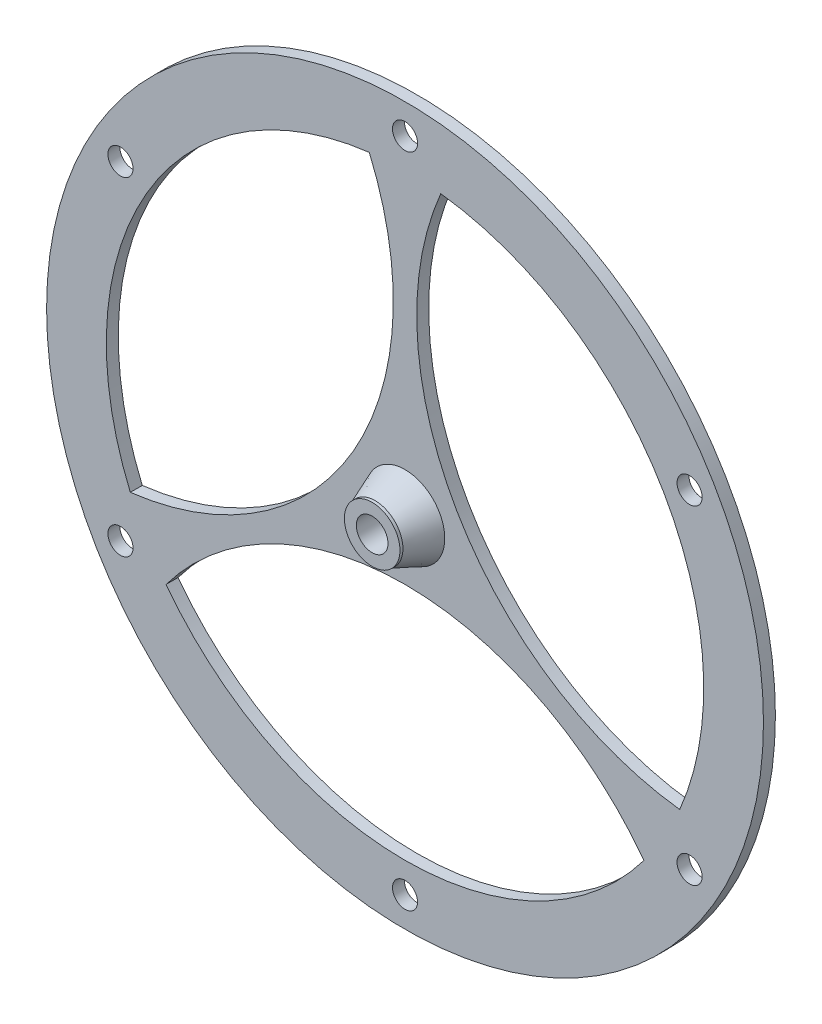
from build123d import *

# Parameters (mm, degrees)
SKETCH1_R           = 60
SKETCH1_R_2         = 2.65
BOSS_EXTRUDE2_DEPTH = 2
CUT_EXTRUDE1_DEPTH  = 85.876380696
CIRPATTERN1_COUNT   = 6
SKETCH3_R           = 4.65
SKETCH3_R_2         = 2.65
BOSS_EXTRUDE3_DEPTH = 5.5
CHAMFER1_SIZE       = 2
CHAMFER1_SIZE2      = 5


with BuildPart() as part:
    # Sketch1 → Boss-Extrude2 (new body)
    with BuildSketch(Plane.XY):
        Circle(SKETCH1_R)
        with BuildLine():
            ThreePointArc((40, -30), (0, -50), (-40, -30))
            ThreePointArc((-40, -30), (0, -10), (40, -30))
        make_face(mode=Mode.SUBTRACT)
        with BuildLine():
            ThreePointArc((-5.980762114, 49.641016151), (-8.660254038, 5), (-45.980762114, -19.641016151))
            ThreePointArc((-45.980762114, -19.641016151), (-43.301270189, 25), (-5.980762114, 49.641016151))
        make_face(mode=Mode.SUBTRACT)
        Circle(SKETCH1_R_2, mode=Mode.SUBTRACT)
        with BuildLine():
            ThreePointArc((5.980762114, 49.641016151), (43.301270189, 25), (45.980762114, -19.641016151))
            ThreePointArc((45.980762114, -19.641016151), (8.660254038, 5), (5.980762114, 49.641016151))
        make_face(mode=Mode.SUBTRACT)
    extrude(amount=BOSS_EXTRUDE2_DEPTH)

    # Sketch2 → Cut-Extrude1 (cut, through all)
    with BuildSketch(Plane.XY.offset(2)):
        with BuildLine():
            ThreePointArc((0, 57.1), (-2.1, 55), (0, 52.9))
            Line((0, 52.9), (0, 57.1))
        make_face()
        with BuildLine():
            Line((0, 57.1), (0, 52.9))
            ThreePointArc((0, 52.9), (1.48492424, 53.51507576), (2.1, 55))
            ThreePointArc((2.1, 55), (1.48492424, 56.48492424), (0, 57.1))
        make_face()
    cut_extrude1 = extrude(amount=-CUT_EXTRUDE1_DEPTH, mode=Mode.SUBTRACT)

    # CirPattern1: Cut-Extrude1 ×6 about axis
    cirpattern1_axis = Axis((0, 0, 0), (0, 0, 1))
    for i in range(1, CIRPATTERN1_COUNT):
        add(cut_extrude1.rotate(cirpattern1_axis, i * 360 / CIRPATTERN1_COUNT), mode=Mode.SUBTRACT)

    # Sketch3 → Boss-Extrude3 (add)
    with BuildSketch(Plane.XY.offset(2)):
        Circle(SKETCH3_R)
        Circle(SKETCH3_R_2, mode=Mode.SUBTRACT)
    extrude(amount=BOSS_EXTRUDE3_DEPTH)

    # Chamfer1
    chamfer1_edges = [part.edges().sort_by_distance(p)[0] for p in [
        (-4.65, 0, 2),
    ]]
    chamfer1_side = [part.faces().sort_by_distance(p)[0] for p in [
        (-58.302943725, 0, 2),
    ]]
    chamfer(chamfer1_edges, length=CHAMFER1_SIZE, length2=CHAMFER1_SIZE2, reference=chamfer1_side[0])


solid = part.part
